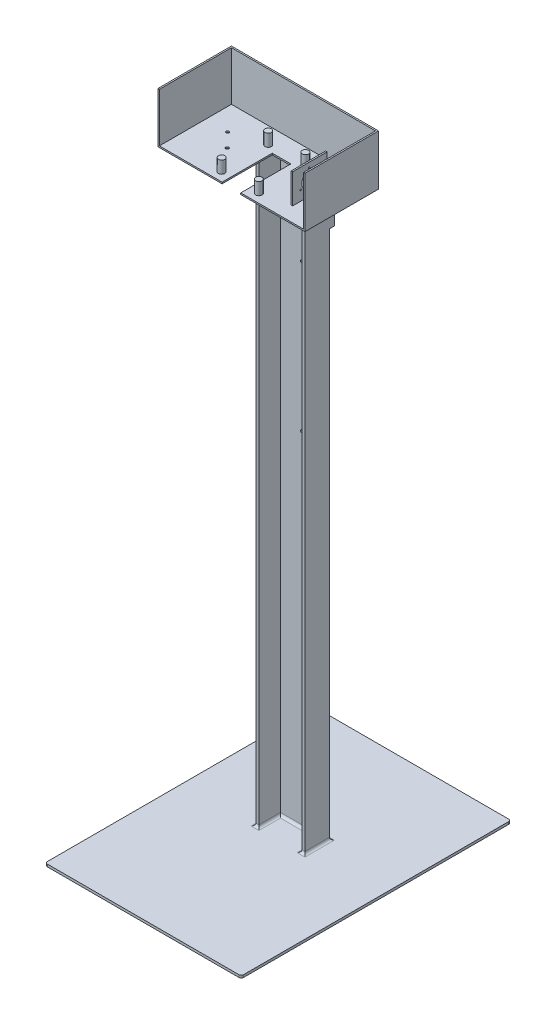
from build123d import *

# Parameters (mm, degrees)
SKETCH1_W             = 400
SKETCH1_H             = 550
BOSS_EXTRUDE2_DEPTH   = 5
EXTRUDE_THIN1_DEPTH   = 1200
FILLET3_R             = 5
BOSS_EXTRUDE4_DEPTH   = 3
SKETCH8_W             = 3
SKETCH8_H             = 70
BOSS_EXTRUDE5_DEPTH   = 60.4
SKETCH9_R             = 15
CUT_EXTRUDE2_DEPTH    = 3
SKETCH10_R            = 1.5
CUT_EXTRUDE3_DEPTH    = 3
SKETCH12_R            = 6.5
BOSS_EXTRUDE6_DEPTH   = 25
SKETCH13_R            = 3
CUT_EXTRUDE5_DEPTH    = 3
EXTRUDE_THIN2_DEPTH   = 100
F_6_0MM_DOWEL_HOLE1_D = 6
SKETCH18_W            = 100
SKETCH18_H            = 40
BOSS_EXTRUDE7_DEPTH   = 10
F_6_0MM_DOWEL_HOLE2_D = 6


with BuildPart() as part:
    # Sketch1 → Boss-Extrude2 (new body)
    with BuildSketch(Plane(origin=(0, 0, 0), x_dir=(1, 0, 0), z_dir=(0, 1, 0))):
        with Locations((200, -275)):
            Rectangle(SKETCH1_W, SKETCH1_H)
    extrude(amount=BOSS_EXTRUDE2_DEPTH)

    # Sketch2 → Extrude-Thin1 (add)
    with BuildSketch(Plane(origin=(0, 5, 0), x_dir=(1, 0, 0), z_dir=(0, 1, 0))):
        Polygon((150, -270), (150, -220), (250, -220), (250, -270), (244, -270), (244, -226), (156, -226), (156, -270), align=None)
    extrude(amount=EXTRUDE_THIN1_DEPTH)

    # Fillet3
    fillet3_edges = [part.edges().sort_by_distance(p)[0] for p in [
        (244, 5, 248),
        (156, 5, 248),
        (200, 5, 226),
        (153, 5, 270),
        (150, 5, 245),
        (200, 5, 220),
        (250, 5, 245),
        (247, 5, 270),
        (0, 2.5, 0),
        (400, 2.5, 0),
        (400, 2.5, 550),
        (0, 2.5, 550),
    ]]
    fillet(fillet3_edges, radius=FILLET3_R)

    # Sketch7 → Boss-Extrude4 (add)
    with BuildSketch(Plane(origin=(0, 1205, 0), x_dir=(1, 0, 0), z_dir=(0, 1, 0))):
        Polygon((350, -220), (50, -220), (50, -370), (181, -370), (181, -267.719735963), (219, -267.719735963), (219, -370), (350, -370), align=None)
    extrude(amount=BOSS_EXTRUDE4_DEPTH)

    # Sketch8 → Boss-Extrude5 (add)
    with BuildSketch(Plane(origin=(0, 1208, 0), x_dir=(1, 0, 0), z_dir=(0, 1, 0))):
        with Locations((293.5, -305)):
            Rectangle(SKETCH8_W, SKETCH8_H)
    extrude(amount=BOSS_EXTRUDE5_DEPTH)

    # Sketch9 → Cut-Extrude2 (cut)
    with BuildSketch(Plane(origin=(295, 0, 0), x_dir=(0, 0, -1), z_dir=(1, 0, 0))):
        with Locations((-306.55, 1238.2)):
            Circle(SKETCH9_R)
    extrude(amount=-CUT_EXTRUDE2_DEPTH, mode=Mode.SUBTRACT)

    # Sketch10 → Cut-Extrude3 (cut)
    with BuildSketch(Plane.ZY.offset(-292)):
        with Locations((306.55, 1258.2)):
            Circle(SKETCH10_R)
        with Locations((289.229491924, 1228.2)):
            Circle(SKETCH10_R)
        with Locations((323.870508076, 1228.2)):
            Circle(SKETCH10_R)
    extrude(amount=-CUT_EXTRUDE3_DEPTH, mode=Mode.SUBTRACT)

    # Sketch12 → Boss-Extrude6 (add)
    with BuildSketch(Plane(origin=(0, 1208, 0), x_dir=(1, 0, 0), z_dir=(0, 1, 0))):
        with Locations(Location((162, -352, 0), (0, 0, 270))):
            Circle(SKETCH12_R)
        with Locations(Location((162, -257, 0), (0, 0, 270))):
            Circle(SKETCH12_R)
        with Locations(Location((238, -257, 0), (0, 0, 270))):
            Circle(SKETCH12_R)
        with Locations(Location((238, -352, 0), (0, 0, 270))):
            Circle(SKETCH12_R)
    extrude(amount=BOSS_EXTRUDE6_DEPTH)

    # Sketch13 → Cut-Extrude5 (cut)
    with BuildSketch(Plane(origin=(0, 1208, 0), x_dir=(1, 0, 0), z_dir=(0, 1, 0))):
        with Locations(Location((126, -304.5, 0), (0, 0, 270))):
            Circle(SKETCH13_R)
        with Locations(Location((98.09349971, -275.842937318, 0), (0, 0, 270))):
            Circle(SKETCH13_R)
    extrude(amount=-CUT_EXTRUDE5_DEPTH, mode=Mode.SUBTRACT)

    # Sketch15 → Extrude-Thin2 (add)
    with BuildSketch(Plane(origin=(0, 1208, 0), x_dir=(1, 0, 0), z_dir=(0, 1, 0))):
        Polygon((350, -370), (350, -220), (50, -220), (50, -370), (53, -370), (53, -223), (347, -223), (347, -370), align=None)
    extrude(amount=EXTRUDE_THIN2_DEPTH)

    # Ø6.0mm Dowel Hole1 (through all)
    with Locations(Plane(origin=(0, 0, 220), x_dir=(-1, 0, 0), z_dir=(0, 0, -1))):
        with Locations((-200, 1005), (-200, 705)):
            Hole(F_6_0MM_DOWEL_HOLE1_D / 2)

    # Sketch18 → Boss-Extrude7 (add)
    with BuildSketch(Plane(origin=(0, 0, 220), x_dir=(-1, 0, 0), z_dir=(0, 0, -1))):
        with Locations((-200, 1185)):
            Rectangle(SKETCH18_W, SKETCH18_H)
        with Locations((-200, 1105)):
            Rectangle(SKETCH18_W, SKETCH18_H)
    extrude(amount=BOSS_EXTRUDE7_DEPTH)

    # Ø6.0mm Dowel Hole2 (through all)
    with Locations(Plane(origin=(0, 0, 210), x_dir=(-1, 0, 0), z_dir=(0, 0, -1))):
        with Locations((-225, 1185), (-175, 1185), (-175, 1105), (-225, 1105)):
            Hole(F_6_0MM_DOWEL_HOLE2_D / 2)


solid = part.part
